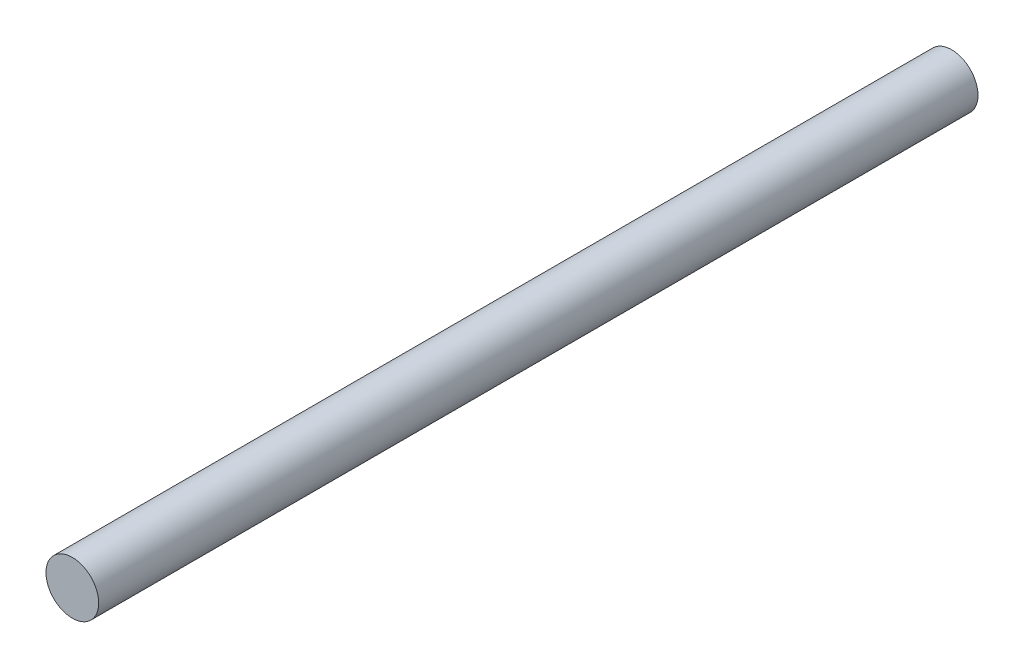
from build123d import *

# Parameters (mm, degrees)
SKETCH1_R           = 6
BOSS_EXTRUDE1_DEPTH = 200


with BuildPart() as part:
    # Sketch1 → Boss-Extrude1 (new body)
    with BuildSketch(Plane(origin=(0, 0, 0), x_dir=(0, 1, 0), z_dir=(0, 0, 1))):
        with Locations(Location((0, 0, 0), (0, 0, 270))):
            Circle(SKETCH1_R)
    extrude(amount=BOSS_EXTRUDE1_DEPTH)


solid = part.part
